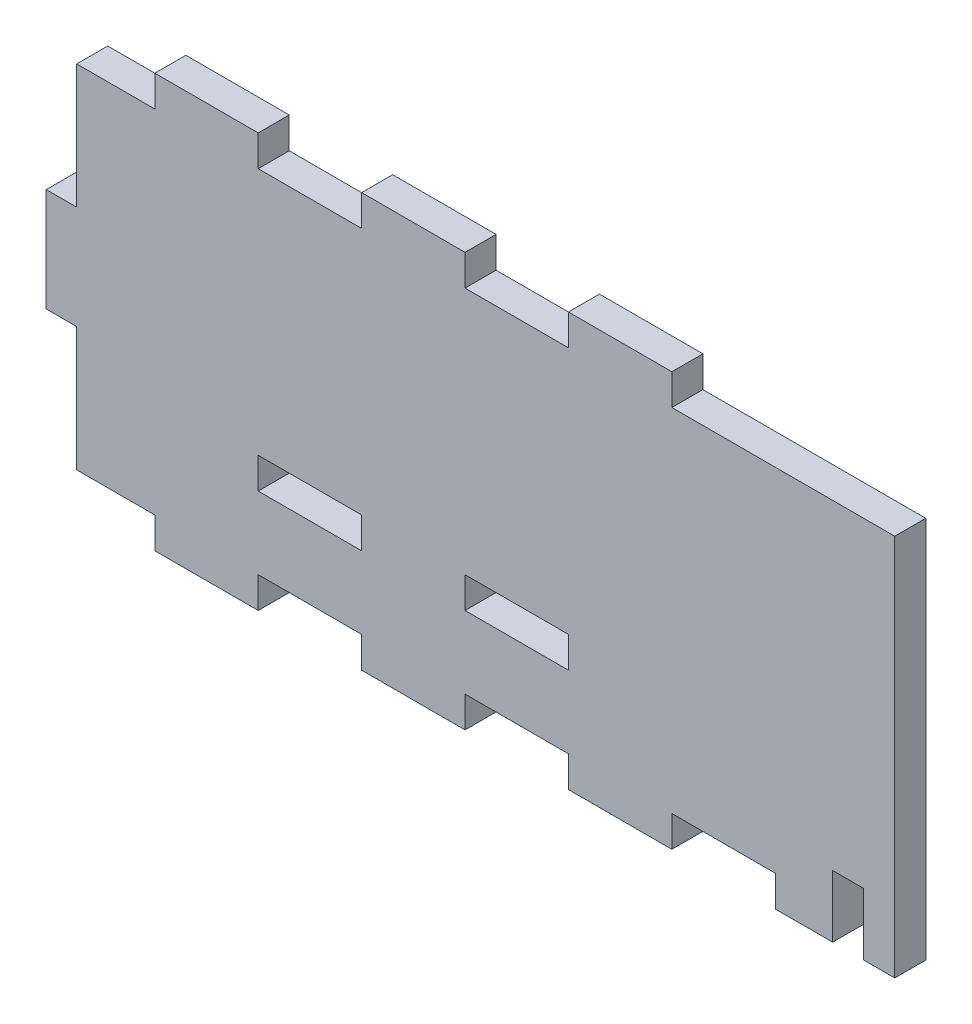
from build123d import *

# Parameters (mm, degrees)
SKETCH_1_W          = 10
SKETCH_1_H          = 3
EXTRUDE_1_DEPTH     = 3
SKETCH_2_W          = 10
SKETCH_2_H          = 3
CUT_EXTRUDE_1_DEPTH = 3
SKETCH_3_W          = 14
SKETCH_3_H          = 34
EXTRUDE_3_DEPTH     = 3
SKETCH_4_W          = 3
SKETCH_4_H          = 3
CUT_EXTRUDE_2_DEPTH = 3
SKETCH_5_W          = 3
SKETCH_5_H          = 3
SKETCH_5_W_2        = 5.553424372
EXTRUDE_4_DEPTH     = 3


with BuildPart() as part:
    # 草圖1 → 填料-伸長1 (new body)
    with BuildSketch(Plane.XY):
        with Locations((-28.088937093, 16.332429501)):
            Rectangle(SKETCH_1_W, SKETCH_1_H)
        with Locations((-8.088937093, 16.332429501)):
            Rectangle(SKETCH_1_W, SKETCH_1_H)
        with Locations((11.911062907, 16.332429501)):
            Rectangle(SKETCH_1_W, SKETCH_1_H)
        Polygon((16.911062907, 14.832429501), (6.911062907, 14.832429501), (-3.088937093, 14.832429501), (-13.088937093, 14.832429501), (-23.088937093, 14.832429501), (-33.088937093, 14.832429501), (-40.642361466, 14.832429501), (-40.642361466, 2.832429501), (-43.588937093, 2.832429501), (-43.588937093, -7.167570499), (-40.642361466, -7.167570499), (-40.642361466, -19.167570499), (-33.088937093, -19.167570499), (-23.088937093, -19.167570499), (-13.088937093, -19.167570499), (-3.088937093, -19.167570499), (6.911062907, -19.167570499), (16.911062907, -19.167570499), (24.464487279, -19.167570499), (24.464487279, -7.167570499), (27.411062907, -7.167570499), (27.411062907, 2.832429501), (24.464487279, 2.832429501), (24.464487279, 14.832429501), align=None)
        with Locations((-28.088937093, -20.667570499)):
            Rectangle(SKETCH_1_W, SKETCH_1_H)
        with Locations((-8.088937093, -20.667570499)):
            Rectangle(SKETCH_1_W, SKETCH_1_H)
        with Locations((11.911062907, -20.667570499)):
            Rectangle(SKETCH_1_W, SKETCH_1_H)
        Polygon((16.911062907, 14.832429501), (6.911062907, 14.832429501), (-3.088937093, 14.832429501), (-13.088937093, 14.832429501), (-23.088937093, 14.832429501), (-33.088937093, 14.832429501), (-40.642361466, 14.832429501), (-40.642361466, 2.832429501), (-43.588937093, 2.832429501), (-43.588937093, -7.167570499), (-40.642361466, -7.167570499), (-40.642361466, -19.167570499), (-33.088937093, -19.167570499), (-23.088937093, -19.167570499), (-13.088937093, -19.167570499), (-3.088937093, -19.167570499), (6.911062907, -19.167570499), (16.911062907, -19.167570499), (24.464487279, -19.167570499), (24.464487279, -7.167570499), (27.411062907, -7.167570499), (27.411062907, 2.832429501), (24.464487279, 2.832429501), (24.464487279, 14.832429501), align=None)
        Polygon((16.911062907, 14.832429501), (6.911062907, 14.832429501), (-3.088937093, 14.832429501), (-13.088937093, 14.832429501), (-23.088937093, 14.832429501), (-33.088937093, 14.832429501), (-40.642361466, 14.832429501), (-40.642361466, 2.832429501), (-43.588937093, 2.832429501), (-43.588937093, -7.167570499), (-40.642361466, -7.167570499), (-40.642361466, -19.167570499), (-33.088937093, -19.167570499), (-23.088937093, -19.167570499), (-13.088937093, -19.167570499), (-3.088937093, -19.167570499), (6.911062907, -19.167570499), (16.911062907, -19.167570499), (24.464487279, -19.167570499), (24.464487279, -7.167570499), (27.411062907, -7.167570499), (27.411062907, 2.832429501), (24.464487279, 2.832429501), (24.464487279, 14.832429501), align=None)
    extrude(amount=EXTRUDE_1_DEPTH)

    # 草圖2 → 除料-伸長1 (cut)
    with BuildSketch(Plane.XY.offset(3)):
        with Locations((1.911062907, -10.667570499)):
            Rectangle(SKETCH_2_W, SKETCH_2_H)
        with Locations((-18.088937093, -10.667570499)):
            Rectangle(SKETCH_2_W, SKETCH_2_H)
    extrude(amount=-CUT_EXTRUDE_1_DEPTH, mode=Mode.SUBTRACT)

    # 草圖3 → 填料-伸長3 (add)
    with BuildSketch(Plane.XY.offset(3)):
        with Locations((31.464487279, -2.167570499)):
            Rectangle(SKETCH_3_W, SKETCH_3_H)
    extrude(amount=-EXTRUDE_3_DEPTH)

    # 草圖4 → 除料-伸長2 (cut)
    with BuildSketch(Plane(origin=(0, 0, 0), x_dir=(-1, 0, 0), z_dir=(0, 0, -1))):
        with Locations((-33.964487279, -17.667570499)):
            Rectangle(SKETCH_4_W, SKETCH_4_H)
    extrude(amount=-CUT_EXTRUDE_2_DEPTH, mode=Mode.SUBTRACT)

    # 草圖5 → 填料-伸長4 (add)
    with BuildSketch(Plane(origin=(0, 0, 0), x_dir=(-1, 0, 0), z_dir=(0, 0, -1))):
        with Locations((-36.964487279, -20.667570499)):
            Rectangle(SKETCH_5_W, SKETCH_5_H)
        with Locations((-29.687775093, -20.667570499)):
            Rectangle(SKETCH_5_W_2, SKETCH_5_H)
    extrude(amount=-EXTRUDE_4_DEPTH)


solid = part.part
